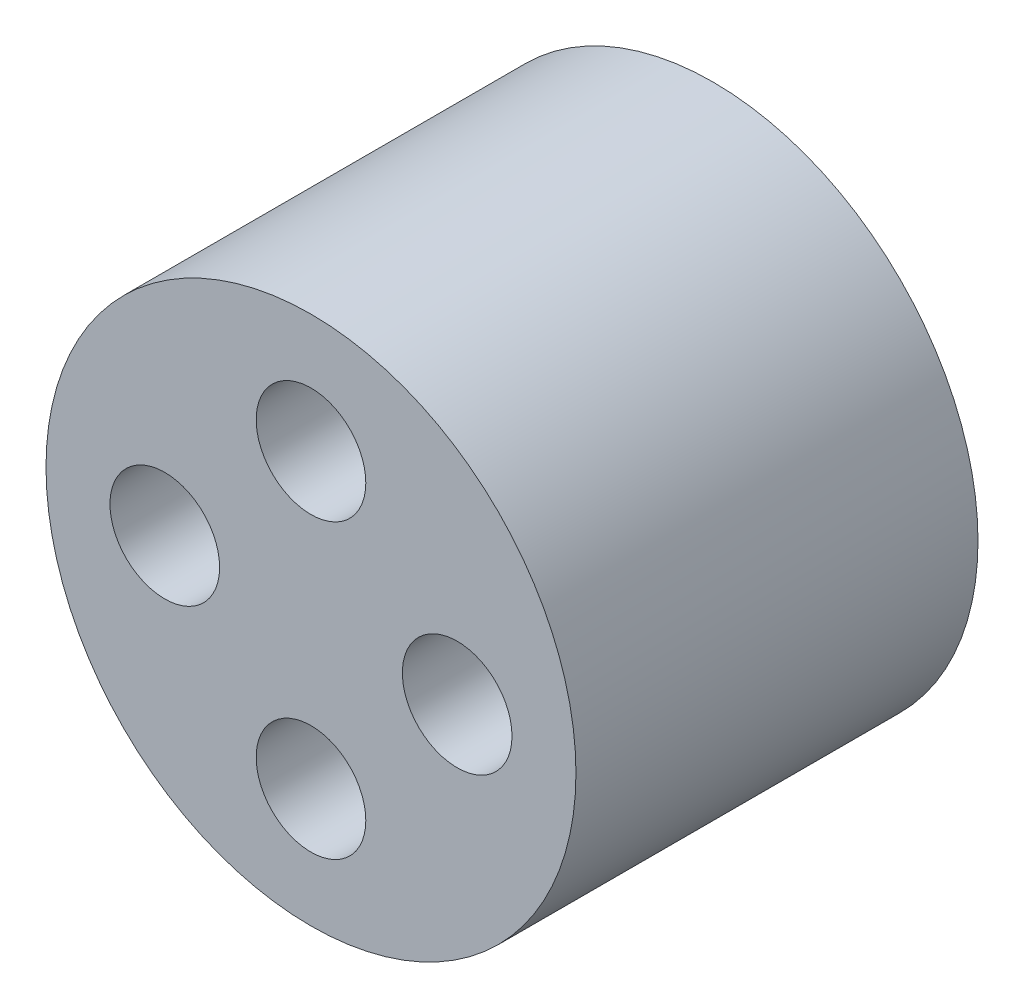
from build123d import *

# Parameters (mm, degrees)
SKIZZE1_R                       = 14.5
SKIZZE1_R_2                     = 1.5
AUFSATZ_LINEAR_AUSTRAGEN1_DEPTH = 22
SKIZZE2_R                       = 3
SCHNITT_LINEAR_AUSTRAGEN1_DEPTH = 17


with BuildPart() as part:
    # Skizze1 → Aufsatz-Linear austragen1 (new body)
    with BuildSketch(Plane.XY):
        Circle(SKIZZE1_R)
        with Locations((8, 0)):
            Circle(SKIZZE1_R_2, mode=Mode.SUBTRACT)
        with Locations((0, -8)):
            Circle(SKIZZE1_R_2, mode=Mode.SUBTRACT)
        with Locations((-8, 0)):
            Circle(SKIZZE1_R_2, mode=Mode.SUBTRACT)
        with Locations((0, 8)):
            Circle(SKIZZE1_R_2, mode=Mode.SUBTRACT)
    extrude(amount=AUFSATZ_LINEAR_AUSTRAGEN1_DEPTH)

    # Skizze2 → Schnitt-Linear austragen1 (cut)
    with BuildSketch(Plane.XY.offset(22)):
        with Locations((0, 8)):
            Circle(SKIZZE2_R)
        with Locations((8, 0)):
            Circle(SKIZZE2_R)
        with Locations((0, -8)):
            Circle(SKIZZE2_R)
        with Locations((-8, 0)):
            Circle(SKIZZE2_R)
    extrude(amount=-SCHNITT_LINEAR_AUSTRAGEN1_DEPTH, mode=Mode.SUBTRACT)


solid = part.part
